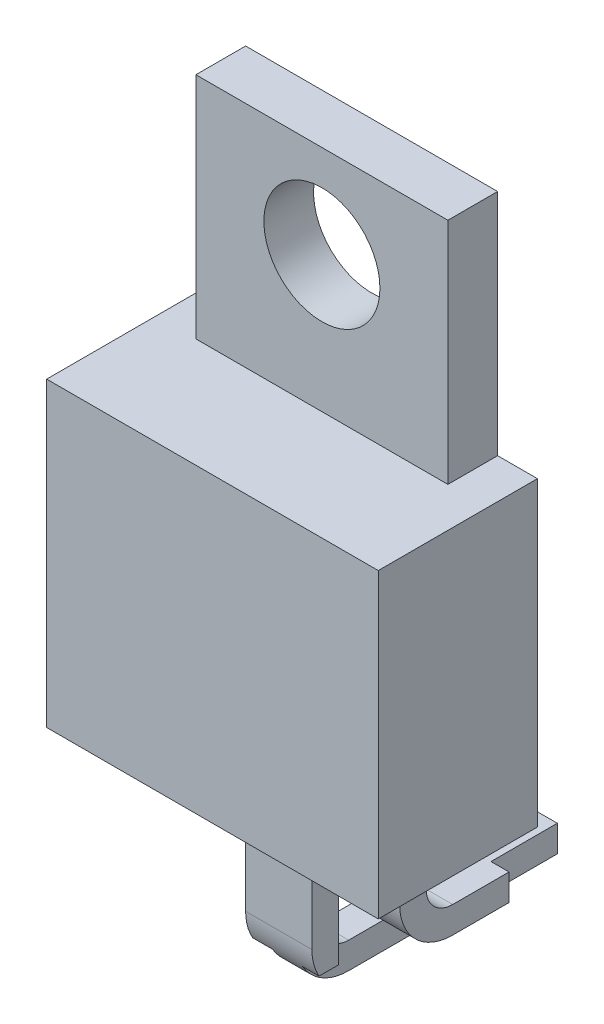
from build123d import *

# Parameters (mm, degrees)
SKETCH_1_R                  = 1.75
EXTRUDE_1_DEPTH             = 4.8
SKETCH_2_W                  = 12.314395844
SKETCH_2_H                  = 6.906876711
CUT_EXTRUDE_1_DEPTH         = 3.3
SKETCH_3_W                  = 2
SKETCH_3_H                  = 0.8
EXTRUDE_2_DEPTH             = 5
SKETCH_4_W                  = 2
SKETCH_4_H                  = 0.8
CUT_EXTRUDE_2_DEPTH         = 2.5
SKETCH_5_W                  = 0.911290814
SKETCH_5_H                  = 0.8
SKETCH_5_W_2                = 2
EXTRUDE_3_DEPTH             = 2.5
EXTRUDE_3_DIRECTION_2_REACH = 21.081
SKETCH_6_W                  = 0.493961758
SKETCH_6_H                  = 0.8
SKETCH_6_W_2                = 0.594747428
CUT_EXTRUDE_3_DEPTH         = 0.4
FILLET_1_R                  = 0.8
FILLET_2_R                  = 1.6
SKETCH_7_W                  = 0.911290814
SKETCH_7_H                  = 0.8
SKETCH_7_W_2                = 0.911290815
EXTRUDE_4_DEPTH             = 2


with BuildPart() as part:
    # Эскиз1 → Вытянуть1 (new body)
    with BuildSketch(Plane.XY):
        Polygon((-3.8, 2.8), (-3.8, -4.1), (-5, -4.1), (-5, -13.2), (5, -13.2), (5, -4.1), (3.8, -4.1), (3.8, 2.8), align=None)
        Circle(SKETCH_1_R, mode=Mode.SUBTRACT)
    extrude(amount=EXTRUDE_1_DEPTH)

    # Эскиз2 → Вырез-Вытянуть1 (cut)
    with BuildSketch(Plane.XY.offset(4.8)):
        with Locations((-0.012289816, -0.646561645)):
            Rectangle(SKETCH_2_W, SKETCH_2_H)
    extrude(amount=-CUT_EXTRUDE_1_DEPTH, mode=Mode.SUBTRACT)

    # Эскиз3 → Вытянуть2 (add)
    with BuildSketch(Plane.XZ.offset(13.2)):
        with Locations((0, 2.4)):
            Rectangle(SKETCH_3_W, SKETCH_3_H)
        with Locations((-2.644349478, 2.4)):
            Rectangle(SKETCH_3_W, SKETCH_3_H)
        with Locations((2.644349478, 2.4)):
            Rectangle(SKETCH_3_W, SKETCH_3_H)
    extrude(amount=EXTRUDE_2_DEPTH)

    # Эскиз4 → Вырез-Вытянуть2 (cut)
    with BuildSketch(Plane.XZ.offset(18.2)):
        with Locations((2.644349478, 2.4)):
            Rectangle(SKETCH_4_W, SKETCH_4_H)
        with Locations((-2.644349478, 2.4)):
            Rectangle(SKETCH_4_W, SKETCH_4_H)
    extrude(amount=-CUT_EXTRUDE_2_DEPTH, mode=Mode.SUBTRACT)

    # Эскиз5 → Вытянуть3 (add)
    with BuildSketch(Plane(origin=(0, 0, 2), x_dir=(-1, 0, 0), z_dir=(0, 0, -1))):
        with Locations((-0.050392835, -18.2)):
            Rectangle(SKETCH_5_W, SKETCH_5_H)
        with Locations((2.644349478, -15.7)):
            Rectangle(SKETCH_5_W_2, SKETCH_5_H)
        with Locations((-2.644349478, -15.7)):
            Rectangle(SKETCH_5_W_2, SKETCH_5_H)
    extrude(amount=EXTRUDE_3_DEPTH)

    # Вытянуть3 direction 2: up to this face of the body (flat: up to its plane)
    extrude_3_direction_2_end = Plane(part.part.faces().sort_by_distance((-2.644349478, -14.45, 2.8))[0])
    # Эскиз5 → Вытянуть3 direction 2 (add, up to the picked face)
    with BuildSketch(Plane(origin=(0, 0, 2), x_dir=(-1, 0, 0), z_dir=(0, 0, -1)), mode=Mode.PRIVATE) as extrude_3_direction_2_sk1:
        with Locations((-0.050392835, -18.2)):
            Rectangle(SKETCH_5_W, SKETCH_5_H)
    extrude_3_direction_2_tool1 = split(extrude(extrude_3_direction_2_sk1.sketch, amount=-EXTRUDE_3_DIRECTION_2_REACH, mode=Mode.PRIVATE), bisect_by=extrude_3_direction_2_end, keep=Keep.BOTH, mode=Mode.PRIVATE)
    # Эскиз5 → Вытянуть3 direction 2 (add, up to the picked face)
    with BuildSketch(Plane(origin=(0, 0, 2), x_dir=(-1, 0, 0), z_dir=(0, 0, -1)), mode=Mode.PRIVATE) as extrude_3_direction_2_sk2:
        with Locations((2.644349478, -15.7)):
            Rectangle(SKETCH_5_W_2, SKETCH_5_H)
    extrude_3_direction_2_tool2 = split(extrude(extrude_3_direction_2_sk2.sketch, amount=-EXTRUDE_3_DIRECTION_2_REACH, mode=Mode.PRIVATE), bisect_by=extrude_3_direction_2_end, keep=Keep.BOTH, mode=Mode.PRIVATE)
    # Эскиз5 → Вытянуть3 direction 2 (add, up to the picked face)
    with BuildSketch(Plane(origin=(0, 0, 2), x_dir=(-1, 0, 0), z_dir=(0, 0, -1)), mode=Mode.PRIVATE) as extrude_3_direction_2_sk3:
        with Locations((-2.644349478, -15.7)):
            Rectangle(SKETCH_5_W_2, SKETCH_5_H)
    extrude_3_direction_2_tool3 = split(extrude(extrude_3_direction_2_sk3.sketch, amount=-EXTRUDE_3_DIRECTION_2_REACH, mode=Mode.PRIVATE), bisect_by=extrude_3_direction_2_end, keep=Keep.BOTH, mode=Mode.PRIVATE)
    add(extrude_3_direction_2_tool1.solids().sort_by(Axis((0.050393, -18.2, 2), (0, 0, 1)))[0])
    add(extrude_3_direction_2_tool2.solids().sort_by(Axis((-2.644349, -15.7, 2), (0, 0, 1)))[0])
    add(extrude_3_direction_2_tool3.solids().sort_by(Axis((2.644349, -15.7, 2), (0, 0, 1)))[0])

    # Эскиз6 → Вырез-Вытянуть3 (cut)
    with BuildSketch(Plane.XZ.offset(18.2)):
        with Locations((0.753019121, 2.4)):
            Rectangle(SKETCH_6_W, SKETCH_6_H)
        with Locations((-0.702626286, 2.4)):
            Rectangle(SKETCH_6_W_2, SKETCH_6_H)
    extrude(amount=-CUT_EXTRUDE_3_DEPTH, mode=Mode.SUBTRACT)

    # Скругление1
    fillet_1_edges = [part.edges().sort_by_distance(p)[0] for p in [
        (0.050392835, -17.8, 2),
        (-2.644349478, -15.3, 2),
        (2.644349478, -15.3, 2),
    ]]
    fillet(fillet_1_edges, radius=FILLET_1_R)

    # Скругление2
    fillet_2_edges = [part.edges().sort_by_distance(p)[0] for p in [
        (-2.644349478, -16.1, 2.8),
        (0.050392835, -18.6, 2.8),
        (2.644349478, -16.1, 2.8),
    ]]
    fillet(fillet_2_edges, radius=FILLET_2_R)

    # Эскиз7 → Вытянуть4 (add)
    with BuildSketch(Plane(origin=(0, 0, -0.5), x_dir=(-1, 0, 0), z_dir=(0, 0, -1))):
        with Locations((-0.050392835, -18.2)):
            Rectangle(SKETCH_7_W, SKETCH_7_H)
        with Locations((-2.644349478, -15.7)):
            Rectangle(SKETCH_7_W_2, SKETCH_7_H)
        with Locations((2.644349478, -15.7)):
            Rectangle(SKETCH_7_W_2, SKETCH_7_H)
    extrude(amount=EXTRUDE_4_DEPTH)


solid = part.part
